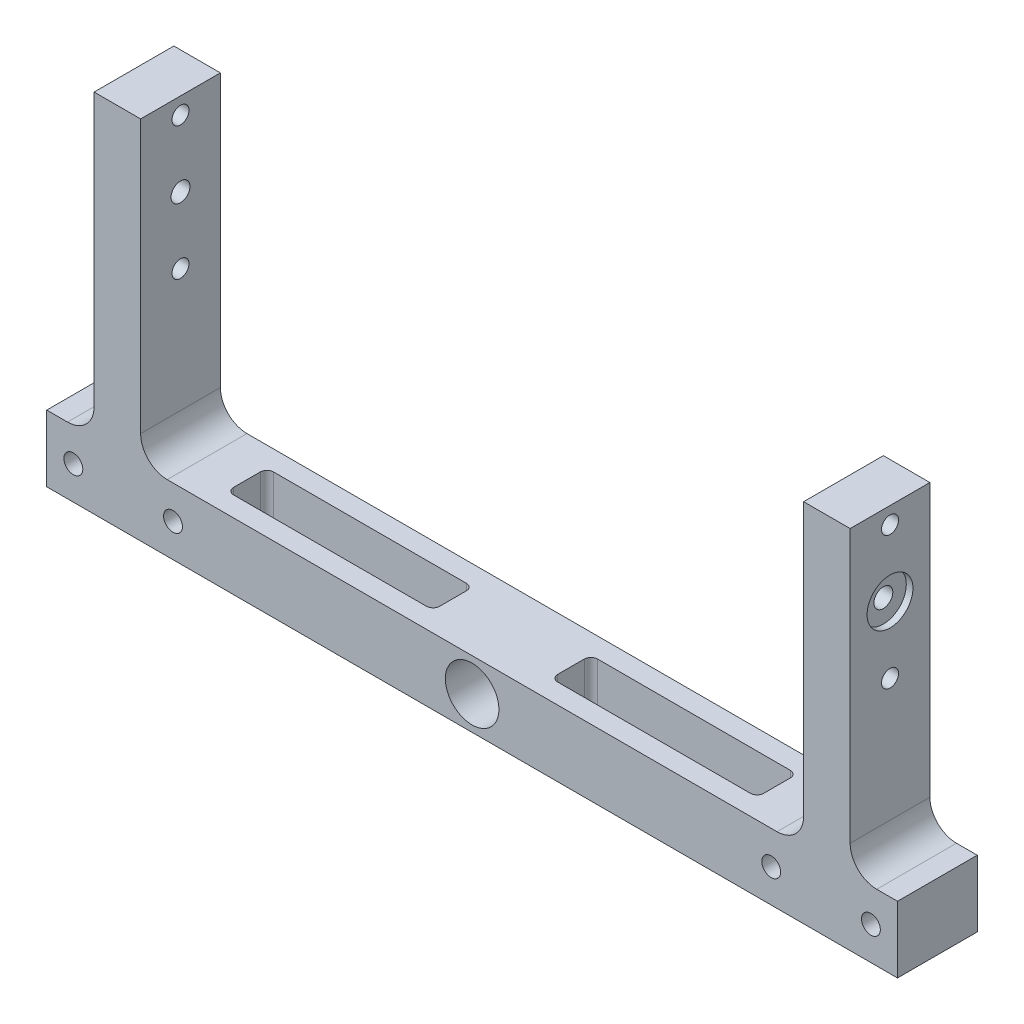
from build123d import *

# Parameters (mm, degrees)
SKETCH1_W           = 162.56
SKETCH1_H           = 12.7
BOSS_EXTRUDE1_DEPTH = 15.24
SKETCH2_R           = 1.8034
CUT_EXTRUDE1_DEPTH  = 15.24
SKETCH3_R           = 5.1181
CUT_EXTRUDE2_DEPTH  = 15.24
SKETCH4_W           = 8.89
SKETCH4_H           = 15.24
BOSS_EXTRUDE2_DEPTH = 57.15
FILLET1_R           = 5.08
SKETCH5_R           = 1.6256
SKETCH5_R_2         = 1.8034
CUT_EXTRUDE3_DEPTH  = 152.4
SKETCH6_R           = 4.3815
CUT_EXTRUDE4_DEPTH  = 1.27
SKETCH7_R           = 3.2639
CUT_EXTRUDE5_DEPTH  = 2.54
SKETCH8_W           = 39.37
SKETCH8_H           = 7.62
CUT_EXTRUDE6_DEPTH  = 25.4
FILLET2_R           = 1.27
FILLET3_R           = 1.27


with BuildPart() as part:
    # Sketch1 → Boss-Extrude1 (new body)
    with BuildSketch(Plane.XY):
        Rectangle(SKETCH1_W, SKETCH1_H)
    extrude(amount=BOSS_EXTRUDE1_DEPTH)

    # Sketch2 → Cut-Extrude1 (cut)
    with BuildSketch(Plane(origin=(0, 0, 0), x_dir=(-1, 0, 0), z_dir=(0, 0, -1))):
        with Locations((-76.2, 0)):
            Circle(SKETCH2_R)
        with Locations((-57.15, 0)):
            Circle(SKETCH2_R)
        with Locations((57.15, 0)):
            Circle(SKETCH2_R)
        with Locations((76.2, 0)):
            Circle(SKETCH2_R)
    extrude(amount=-CUT_EXTRUDE1_DEPTH, mode=Mode.SUBTRACT)

    # Sketch3 → Cut-Extrude2 (cut)
    with BuildSketch(Plane(origin=(0, 0, 0), x_dir=(-1, 0, 0), z_dir=(0, 0, -1))):
        Circle(SKETCH3_R)
    extrude(amount=-CUT_EXTRUDE2_DEPTH, mode=Mode.SUBTRACT)

    # Sketch4 → Boss-Extrude2 (add)
    with BuildSketch(Plane(origin=(0, 6.35, 0), x_dir=(1, 0, 0), z_dir=(0, 1, 0))):
        with Locations((67.78498, -7.62)):
            Rectangle(SKETCH4_W, SKETCH4_H)
        with Locations((-67.78752, -7.62)):
            Rectangle(SKETCH4_W, SKETCH4_H)
    extrude(amount=BOSS_EXTRUDE2_DEPTH)

    # Fillet1
    fillet1_edges = [part.edges().sort_by_distance(p)[0] for p in [
        (72.22998, 6.35, 7.62),
        (63.33998, 6.35, 7.62),
        (-63.34252, 6.35, 7.62),
        (-72.23252, 6.35, 7.62),
    ]]
    fillet(fillet1_edges, radius=FILLET1_R)

    # Sketch5 → Cut-Extrude3 (cut)
    with BuildSketch(Plane(origin=(72.22998, 0, 0), x_dir=(0, 0, -1), z_dir=(1, 0, 0))):
        with Locations((-7.62, 60.325)):
            Circle(SKETCH5_R)
        with Locations((-7.62, 34.925)):
            Circle(SKETCH5_R)
        with Locations((-7.62, 47.625)):
            Circle(SKETCH5_R_2)
    extrude(amount=-CUT_EXTRUDE3_DEPTH, mode=Mode.SUBTRACT)

    # Sketch6 → Cut-Extrude4 (cut)
    with BuildSketch(Plane(origin=(72.22998, 0, 0), x_dir=(0, 0, -1), z_dir=(1, 0, 0))):
        with Locations((-7.62, 47.625)):
            Circle(SKETCH6_R)
    extrude(amount=-CUT_EXTRUDE4_DEPTH, mode=Mode.SUBTRACT)

    # Sketch7 → Cut-Extrude5 (cut)
    with BuildSketch(Plane.ZY.offset(72.23252)):
        with Locations((7.62, 47.625)):
            Circle(SKETCH7_R)
    extrude(amount=-CUT_EXTRUDE5_DEPTH, mode=Mode.SUBTRACT)

    # Sketch8 → Cut-Extrude6 (cut)
    with BuildSketch(Plane(origin=(0, 6.35, 0), x_dir=(1, 0, 0), z_dir=(0, 1, 0))):
        with Locations((30.95498, -7.62)):
            Rectangle(SKETCH8_W, SKETCH8_H)
        with Locations((-30.95752, -7.62)):
            Rectangle(SKETCH8_W, SKETCH8_H)
    extrude(amount=-CUT_EXTRUDE6_DEPTH, mode=Mode.SUBTRACT)

    # Fillet2
    fillet2_edges = [part.edges().sort_by_distance(p)[0] for p in [
        (11.26998, 0, 11.43),
        (11.26998, 0, 3.81),
        (50.63998, 0, 3.81),
        (50.63998, 0, 11.43),
    ]]
    fillet(fillet2_edges, radius=FILLET2_R)

    # Fillet3
    fillet3_edges = [part.edges().sort_by_distance(p)[0] for p in [
        (-50.64252, 0, 11.43),
        (-50.64252, 0, 3.81),
        (-11.27252, 0, 3.81),
        (-11.27252, 0, 11.43),
    ]]
    fillet(fillet3_edges, radius=FILLET3_R)


solid = part.part
